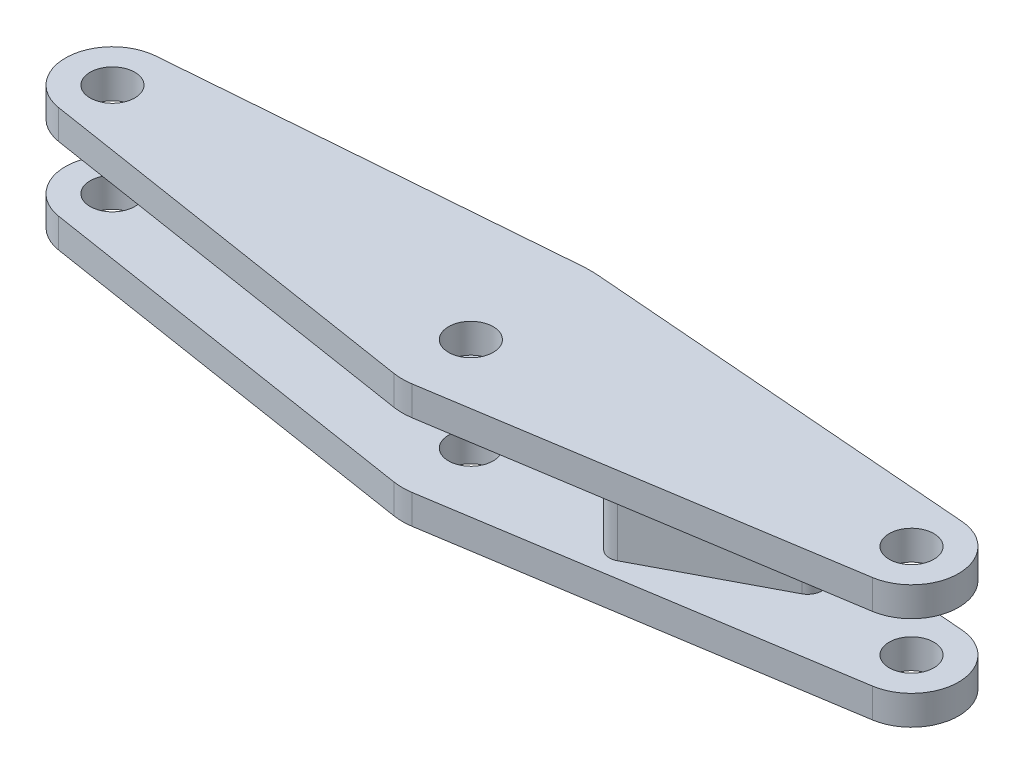
from build123d import *

# Parameters (mm, degrees)
SKETCH1_R                = 0.95
BOSS_EXTRUDE1_DEPTH      = 2.625
CUT_EXTRUDE1_DEPTH       = 20.73976722
CUT_EXTRUDE1_DEPTH_BACK  = 20.73976722
SKETCH3_W                = 38
SKETCH3_H                = 2.75
BOSS_EXTRUDE2_DEPTH      = 2.625
BOSS_EXTRUDE2_DEPTH_BACK = 1.375


with BuildPart() as part:
    # Sketch1 → Boss-Extrude1 (new, symmetric)
    with BuildSketch(Plane(origin=(0, 0, 0), x_dir=(1, 0, 0), z_dir=(0, 1, 0))):
        with BuildLine():
            Line((-0.393995074, 3.318856737), (-17.15759803, 1.993781046))
            ThreePointArc((-17.15759803, 1.993781046), (-18.998517745, 0.076985867), (-17.310510206, -1.975748823))
            Line((-17.310510206, -1.975748823), (-0.388137758, -4.635281908))
            ThreePointArc((-0.388137758, -4.635281908), (0, -4.665595879), (0.388137758, -4.635281908))
            Line((0.388137758, -4.635281908), (17.310510206, -1.975748823))
            ThreePointArc((17.310510206, -1.975748823), (18.998517745, 0.076985867), (17.15759803, 1.993781046))
            Line((17.15759803, 1.993781046), (0.393995074, 3.318856737))
            ThreePointArc((0.393995074, 3.318856737), (0, 3.334404121), (-0.393995074, 3.318856737))
        make_face()
        with Locations(Location((-17, 0, 0), (0, 0, 90))):
            Circle(SKETCH1_R, mode=Mode.SUBTRACT)
        with Locations(Location((17, 0, 0), (0, 0, 90))):
            Circle(SKETCH1_R, mode=Mode.SUBTRACT)
        with Locations(Location((0, -1.75, 0), (0, 0, 90))):
            Circle(SKETCH1_R, mode=Mode.SUBTRACT)
    extrude(amount=BOSS_EXTRUDE1_DEPTH, both=True)

    # Sketch3 → Cut-Extrude1 (cut, two sides: drawn at the far end of the back side and taken through both)
    with BuildSketch(Plane.XY.offset(-CUT_EXTRUDE1_DEPTH_BACK)):
        Rectangle(SKETCH3_W, SKETCH3_H)
    extrude(amount=CUT_EXTRUDE1_DEPTH + CUT_EXTRUDE1_DEPTH_BACK, mode=Mode.SUBTRACT)


with BuildPart() as cut_extrude1_piece_1:
    # of the separate pieces the step leaves, piece 1, a body of its own (cut_extrude1_pieces)
    add(part.part.solids().sort_by_distance((17.15759803, -1.375, -1.993781046))[0])



with BuildPart() as cut_extrude1_piece_2:
    # of the separate pieces the step leaves, piece 2, a body of its own (cut_extrude1_pieces)
    add(part.part.solids().sort_by_distance((17.15759803, 2.625, -1.993781046))[0])


with BuildPart() as cut_extrude1_piece_1_1:
    add(cut_extrude1_piece_1.part)

    add(cut_extrude1_piece_2.part)  # Boss-Extrude2 merges Cut-Extrude1 piece 2
    # Sketch4 → Boss-Extrude2 (add, two sides: drawn at the far end of the back side and taken through both)
    with BuildSketch(Plane(origin=(0, 0, 0), x_dir=(1, 0, 0), z_dir=(0, 1, 0)).offset(-BOSS_EXTRUDE2_DEPTH_BACK)):
        with BuildLine():
            Line((12.412535452, -0.081023287), (7.279310345, -2.781023287))
            ThreePointArc((7.279310345, -2.781023287), (6.468976713, -2.529310345), (6.720689655, -1.718976713))
            Line((6.720689655, -1.718976713), (11.853914762, 0.981023287))
            ThreePointArc((11.853914762, 0.981023287), (12.664248394, 0.729310345), (12.412535452, -0.081023287))
        make_face()
    extrude(amount=BOSS_EXTRUDE2_DEPTH + BOSS_EXTRUDE2_DEPTH_BACK)


solid = cut_extrude1_piece_1_1.part
